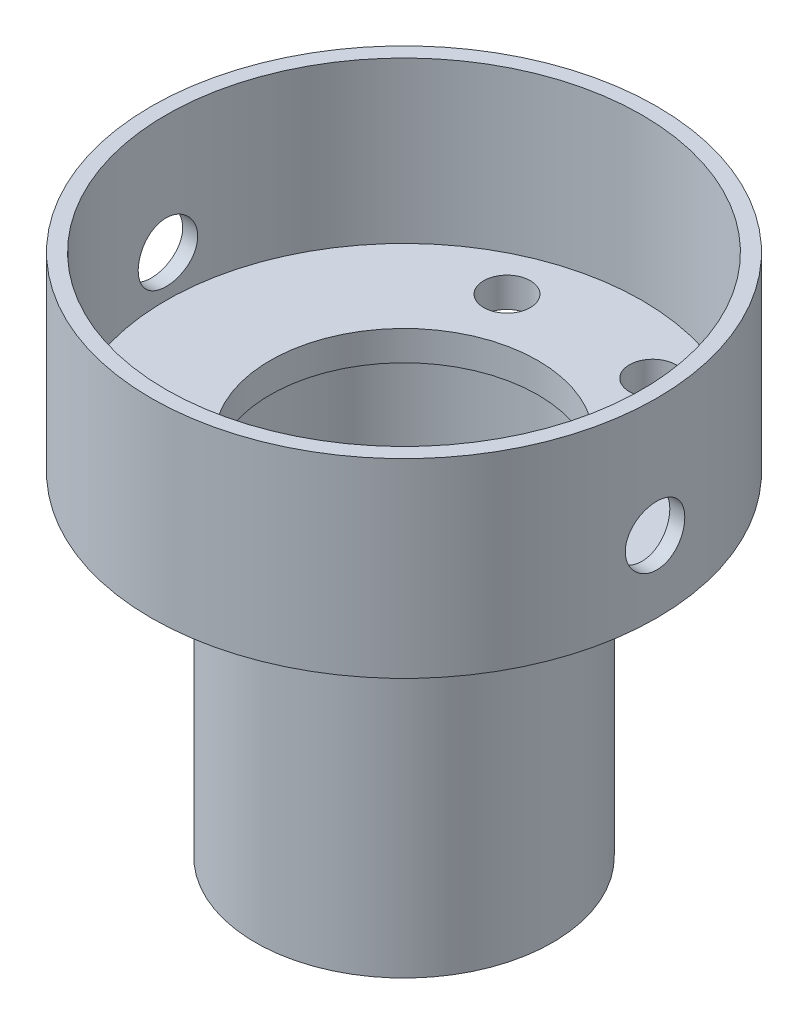
from build123d import *

# Parameters (mm, degrees)
SKETCH1_R                  = 15.875
EXTRUDE2_DEPTH             = 38.1
SKETCH2_R                  = 4.7625
CUT_EXTRUDE1_DEPTH         = 45.22263278
SKETCH8_R                  = 15.08125
CUT_EXTRUDE3_DEPTH         = 34.925
SKETCH9_R                  = 24.789766377
CUT_EXTRUDE4_DEPTH         = 2.54
SKETCH10_R                 = 26.9875
EXTRUDE3_DEPTH             = 20.32
SKETCH11_R                 = 25.4
CUT_EXTRUDE5_DEPTH         = 17.145
SKETCH12_R                 = 14.2875
CUT_EXTRUDE6_DEPTH         = 53.16477655
F_9_0_196_DIAMETER_HOLE1_D = 4.9784
CIRPATTERN1_COUNT          = 2
CIRPATTERN1_ANGLE          = 45
SKETCH17_R                 = 3.175
CUT_EXTRUDE7_DEPTH         = 86.064550432
CIRPATTERN2_COUNT          = 2


with BuildPart() as part:
    # Sketch1 → Extrude2 (new body)
    with BuildSketch(Plane(origin=(0, 0, 0), x_dir=(1, 0, 0), z_dir=(0, 1, 0))):
        with Locations(Location((0, 0, 0), (0, 0, 90))):
            Circle(SKETCH1_R)
    extrude(amount=EXTRUDE2_DEPTH)

    # Sketch2 → Cut-Extrude1 (cut, through all)
    with BuildSketch(Plane.XZ):
        with Locations(Location((0, 0, 0), (0, 0, 270))):
            Circle(SKETCH2_R)
    extrude(amount=-CUT_EXTRUDE1_DEPTH, mode=Mode.SUBTRACT)

    # Sketch8 → Cut-Extrude3 (cut)
    with BuildSketch(Plane(origin=(0, 38.1, 0), x_dir=(-1, 0, 0), z_dir=(0, 1, 0))):
        with Locations(Location((0, 0, 0), (0, 0, 90))):
            Circle(SKETCH8_R)
    extrude(amount=-CUT_EXTRUDE3_DEPTH, mode=Mode.SUBTRACT)

    # Sketch9 → Cut-Extrude4 (cut)
    with BuildSketch(Plane(origin=(0, 38.1, 0), x_dir=(-1, 0, 0), z_dir=(0, 1, 0))):
        Circle(SKETCH9_R)
    extrude(amount=-CUT_EXTRUDE4_DEPTH, mode=Mode.SUBTRACT)

    # Sketch10 → Extrude3 (add)
    with BuildSketch(Plane(origin=(0, 35.56, 0), x_dir=(-1, 0, 0), z_dir=(0, 1, 0))):
        with Locations(Location((0, 0, 0), (0, 0, 90))):
            Circle(SKETCH10_R)
    extrude(amount=EXTRUDE3_DEPTH)

    # Sketch11 → Cut-Extrude5 (cut)
    with BuildSketch(Plane(origin=(0, 55.88, 0), x_dir=(-1, 0, 0), z_dir=(0, 1, 0))):
        with Locations(Location((0, 0, 0), (0, 0, 90))):
            Circle(SKETCH11_R)
    extrude(amount=-CUT_EXTRUDE5_DEPTH, mode=Mode.SUBTRACT)

    # Sketch12 → Cut-Extrude6 (cut, through all)
    with BuildSketch(Plane(origin=(0, 35.56, 0), x_dir=(-1, 0, 0), z_dir=(0, 1, 0))):
        with Locations(Location((0, 0, 0), (0, 0, 90))):
            Circle(SKETCH12_R)
    extrude(amount=CUT_EXTRUDE6_DEPTH, mode=Mode.SUBTRACT)

    # #9 (0.196) Diameter Hole1 (through all)
    with Locations(Plane(origin=(-7.776127346, 55.88, -18.773232101), x_dir=(0, 0, 1), z_dir=(0, 1, 0))):
        with Locations((0, 0)):
            f_9_0_196_diameter_hole1 = Hole(F_9_0_196_DIAMETER_HOLE1_D / 2)

    # CirPattern1: #9 (0.196) Diameter Hole1 ×2 about axis
    cirpattern1_axis = Axis((0, 83.588580262, 0), (0, -1, 0))
    for i in range(1, CIRPATTERN1_COUNT):
        add(f_9_0_196_diameter_hole1.rotate(cirpattern1_axis, i * CIRPATTERN1_ANGLE / (CIRPATTERN1_COUNT - 1)), mode=Mode.SUBTRACT)

    # Sketch17 → Cut-Extrude7 (cut, through all)
    with BuildSketch(Plane(origin=(41.153091309, 43.18, 0), x_dir=(0, 0, -1), z_dir=(1, 0, 0))):
        Circle(SKETCH17_R)
    extrude(amount=-CUT_EXTRUDE7_DEPTH, mode=Mode.SUBTRACT)

    # Sketch20 → #10-32 Tapped Hole1 (revolve, cut)
    with BuildSketch(Plane(origin=(11.175940885, 0, 0.036350046), x_dir=(0, 0, -1), z_dir=(1, 0, 0))):
        Polygon((0, 0), (0, 13.252917848), (2.0193, 12.0396), (2.0193, 0), align=None)
    f_10_32_tapped_hole1 = revolve(axis=Axis((11.175940885, -6.35, 0.036350046), (0, 1, 0)), mode=Mode.SUBTRACT)

    # CirPattern2: #10-32 Tapped Hole1 ×2 about axis
    cirpattern2_axis = Axis((0, 0, 0), (0, 1, 0))
    for i in range(1, CIRPATTERN2_COUNT):
        add(f_10_32_tapped_hole1.rotate(cirpattern2_axis, i * 360 / CIRPATTERN2_COUNT), mode=Mode.SUBTRACT)


solid = part.part
